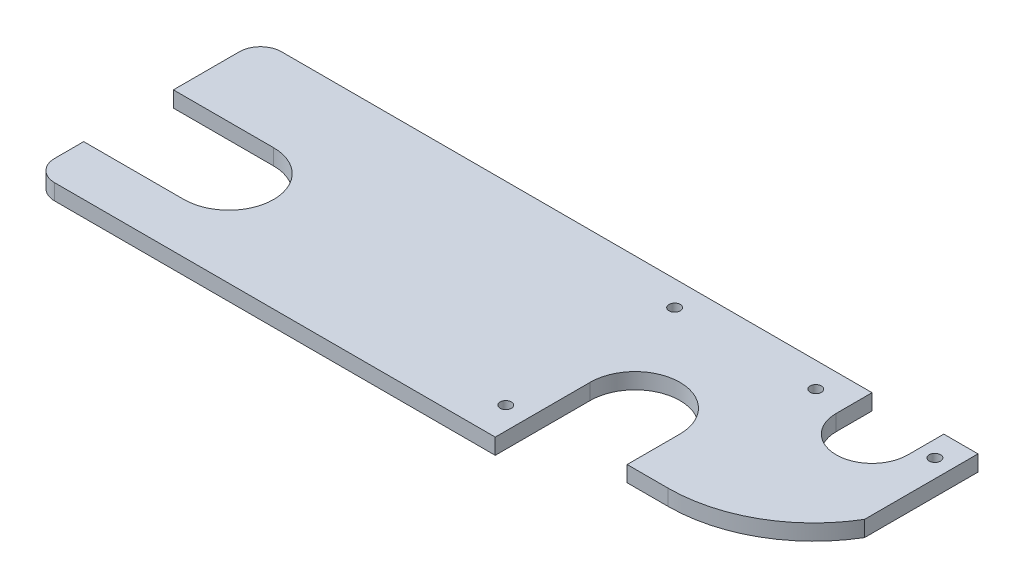
from build123d import *

# Parameters (mm, degrees)
BOSS_EXTRUDE2_DEPTH     = 9.525
CUT_EXTRUDE2_DEPTH      = 453.969139401
F_1_4_CLEARANCE_HOLE1_D = 6.7564


with BuildPart() as part:
    # Sketch1 → Boss-Extrude2 (new body)
    with BuildSketch(Plane(origin=(0, 0, 0), x_dir=(1, 0, 0), z_dir=(0, 1, 0))):
        with BuildLine():
            Line((25.4, 0), (277.8125, 0))
            Line((277.8125, 0), (277.8125, 57.15))
            ThreePointArc((277.8125, 57.15), (304.8, 84.1375), (331.78749993, 57.15))
            Line((331.78749993, 57.15), (331.78749993, 0))
            Line((331.78749993, 0), (357.18749993, 0))
            ThreePointArc((357.18749993, 0), (407.751306336, 19.640432558), (431.8, 68.2625))
            Line((431.8, 68.2625), (431.8, 136.525))
            Line((431.8, 136.525), (411.226, 136.525))
            Line((411.226, 136.525), (411.226, 114.935))
            ThreePointArc((411.226, 114.935), (389.636, 93.345), (368.046, 114.935))
            Line((368.046, 114.935), (368.046, 136.525))
            Line((368.046, 136.525), (23.8125, 136.525))
            Line((23.8125, 136.525), (12.7, 136.525))
            ThreePointArc((12.7, 136.525), (3.719743879, 132.805256121), (0, 123.825))
            Line((0, 123.825), (0, 96.8375))
            Line((0, 96.8375), (0, 84.1375))
            Line((0, 84.1375), (22.225, 84.1375))
            Line((22.225, 84.1375), (60.325, 84.1375))
            ThreePointArc((60.325, 84.1375), (79.408044257, 76.233044257), (87.3125, 57.15))
            ThreePointArc((87.3125, 57.15), (79.408044257, 38.066955743), (60.325, 30.1625))
            Line((60.325, 30.1625), (22.225, 30.1625))
            Line((22.225, 30.1625), (0, 30.1625))
            Line((0, 30.1625), (0, 17.4625))
            Line((0, 17.4625), (0, 12.7))
            ThreePointArc((0, 12.7), (3.719743879, 3.719743879), (12.7, 0))
            Line((12.7, 0), (25.4, 0))
        make_face()
    extrude(amount=BOSS_EXTRUDE2_DEPTH)

    # Sketch2 → Cut-Extrude2 (cut, through all)
    with BuildSketch(Plane(origin=(0, 9.525, 0), x_dir=(1, 0, 0), z_dir=(0, 1, 0))):
        with BuildLine():
            Line((331.78749993, 0), (331.78749993, 25.4))
            Line((331.78749993, 25.4), (356.39375, 25.4))
            ThreePointArc((356.39375, 25.4), (399.762219091, 36.86444095), (431.8, 68.2625))
            ThreePointArc((431.8, 68.2625), (407.751306336, 19.640432558), (357.18749993, 0))
            Line((357.18749993, 0), (331.78749993, 0))
        make_face()
    extrude(amount=-CUT_EXTRUDE2_DEPTH, mode=Mode.SUBTRACT)

    # 1/4 Clearance Hole1 (through all)
    with Locations(Plane(origin=(0, 9.525, 0), x_dir=(1, 0, 0), z_dir=(0, 1, 0))):
        with Locations((420.9542, 121.44375), (349.26905, 121.44375), (264.318750035, 121.44375), (264.318750035, 19.84375)):
            Hole(F_1_4_CLEARANCE_HOLE1_D / 2)


solid = part.part
